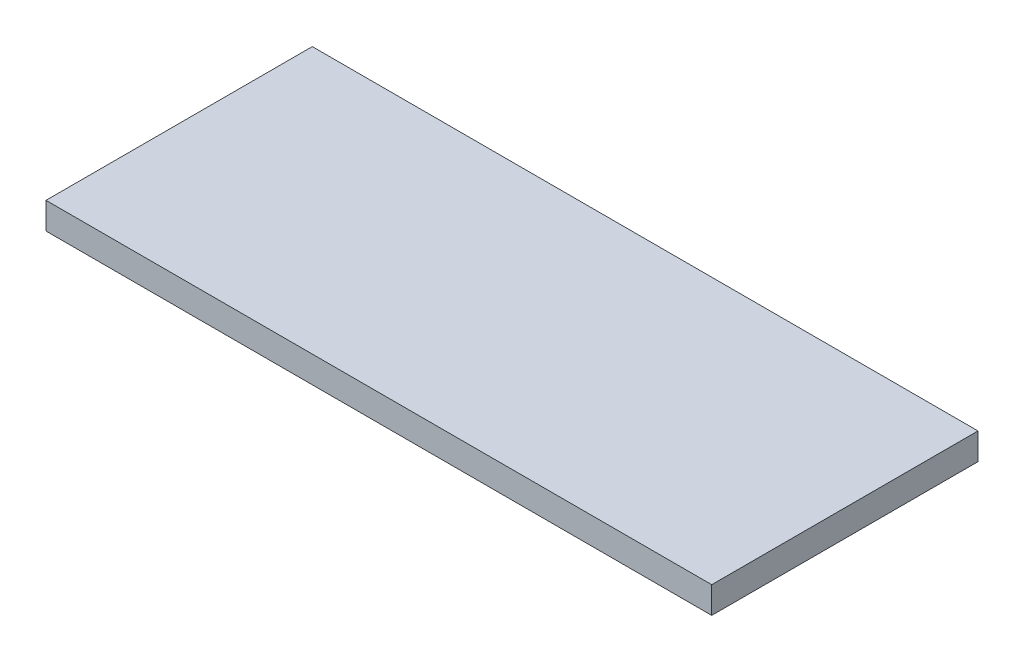
from build123d import *

# Parameters (mm, degrees)
SKETCH1_W           = 50
SKETCH1_H           = 20
BOSS_EXTRUDE1_DEPTH = 2


with BuildPart() as part:
    # Sketch1 → Boss-Extrude1 (new body)
    with BuildSketch(Plane(origin=(0, 0, 0), x_dir=(1, 0, 0), z_dir=(0, 1, 0))):
        Rectangle(SKETCH1_W, SKETCH1_H)
    extrude(amount=BOSS_EXTRUDE1_DEPTH)


solid = part.part
